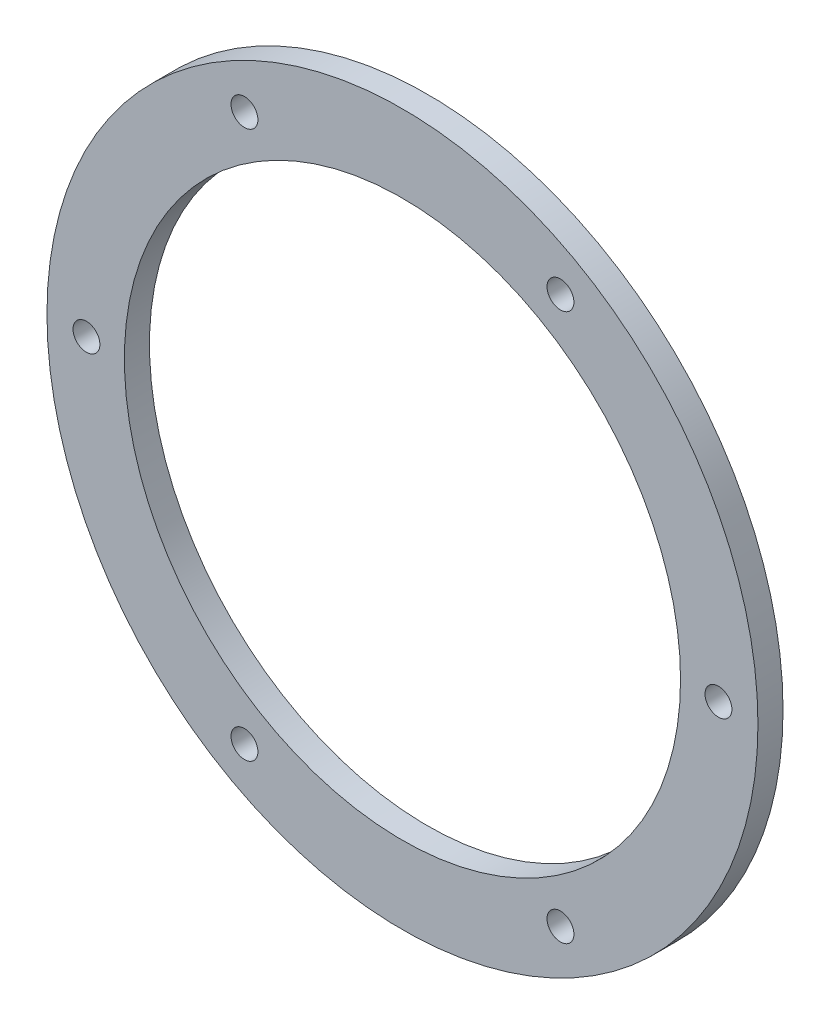
from build123d import *

# Parameters (mm, degrees)
ARO_START         = 69.85
CROQUIS1_R        = 45
CROQUIS1_R_2      = 35.2
ARO_DEPTH         = 3.175
BARRENOS_M3_START = 69.85
CROQUIS2_R        = 1.7
BARRENOS_M3_DEPTH = 3.175


with BuildPart() as part:
    # Croquis1 → Aro (new body)
    with BuildSketch(Plane.XY.offset(ARO_START)):
        Circle(CROQUIS1_R)
        Circle(CROQUIS1_R_2, mode=Mode.SUBTRACT)
    extrude(amount=ARO_DEPTH)

    # Croquis2 → Barrenos_M3 (cut)
    with BuildSketch(Plane.XY.offset(BARRENOS_M3_START)):
        with Locations((40, 0)):
            Circle(CROQUIS2_R)
        with Locations((20, 34.641016151)):
            Circle(CROQUIS2_R)
        with Locations((-20, 34.641016151)):
            Circle(CROQUIS2_R)
        with Locations((-40, 0)):
            Circle(CROQUIS2_R)
        with Locations((-20, -34.641016151)):
            Circle(CROQUIS2_R)
        with Locations((20, -34.641016151)):
            Circle(CROQUIS2_R)
    extrude(amount=BARRENOS_M3_DEPTH, mode=Mode.SUBTRACT)


solid = part.part
